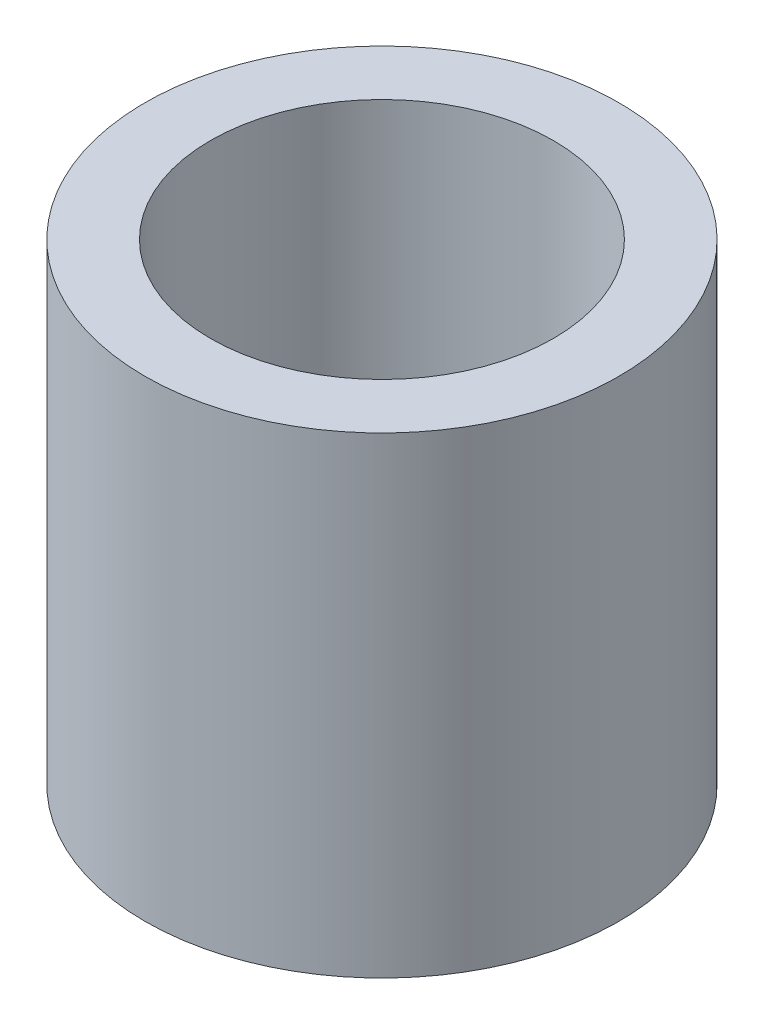
from build123d import *

# Parameters (mm, degrees)
SKETCH1_R           = 12.3
BOSS_EXTRUDE1_DEPTH = 24.5
SKETCH2_R           = 8.9
CUT_EXTRUDE1_DEPTH  = 20
SKETCH3_R           = 7.4
CUT_EXTRUDE2_DEPTH  = 1
SKETCH4_R           = 4.5
CUT_EXTRUDE3_DEPTH  = 30.237475951


with BuildPart() as part:
    # Sketch1 → Boss-Extrude1 (new body)
    with BuildSketch(Plane(origin=(0, 0, 0), x_dir=(1, 0, 0), z_dir=(0, 1, 0))):
        with Locations(Location((0, 0, 0), (0, 0, 270))):
            Circle(SKETCH1_R)
    extrude(amount=BOSS_EXTRUDE1_DEPTH)

    # Sketch2 → Cut-Extrude1 (cut)
    with BuildSketch(Plane(origin=(0, 24.5, 0), x_dir=(1, 0, 0), z_dir=(0, 1, 0))):
        with Locations(Location((0, 0, 0), (0, 0, 270))):
            Circle(SKETCH2_R)
    extrude(amount=-CUT_EXTRUDE1_DEPTH, mode=Mode.SUBTRACT)

    # Sketch3 → Cut-Extrude2 (cut)
    with BuildSketch(Plane.XZ):
        with Locations(Location((0, 0, 0), (0, 0, 270))):
            Circle(SKETCH3_R)
    extrude(amount=-CUT_EXTRUDE2_DEPTH, mode=Mode.SUBTRACT)

    # Sketch4 → Cut-Extrude3 (cut, through all)
    with BuildSketch(Plane.XZ.offset(-1)):
        with Locations(Location((0, 0, 0), (0, 0, 270))):
            Circle(SKETCH4_R)
    extrude(amount=-CUT_EXTRUDE3_DEPTH, mode=Mode.SUBTRACT)


solid = part.part
